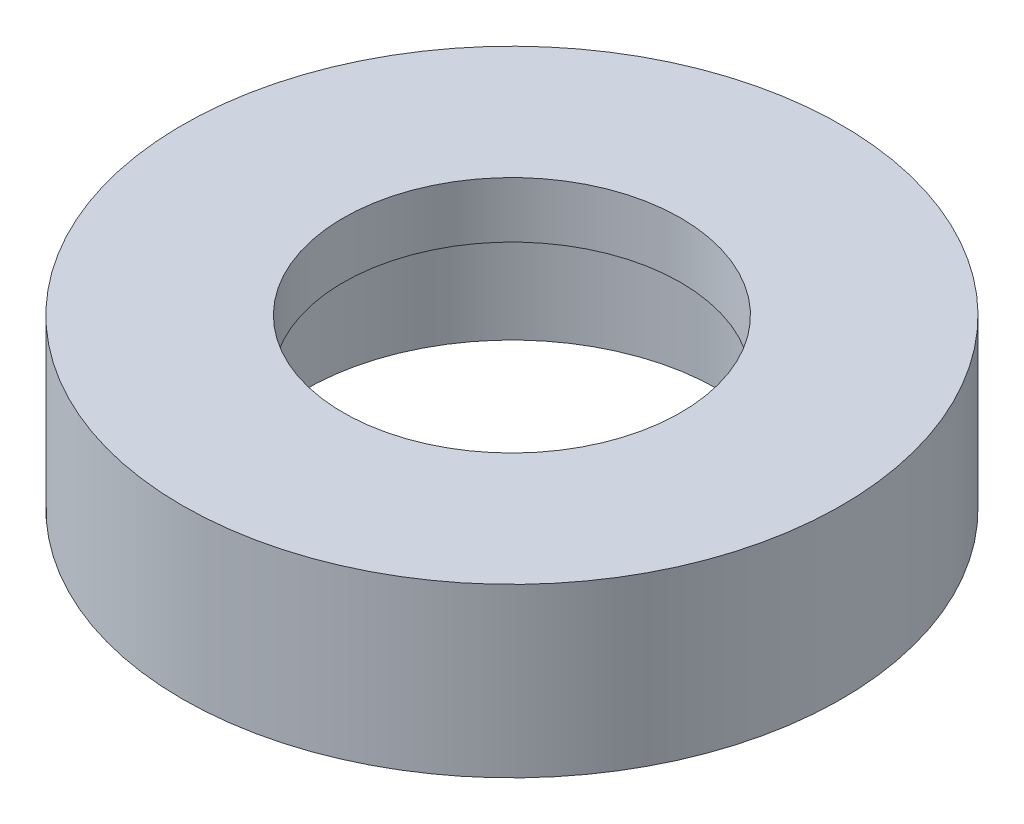
from build123d import *

# Parameters (mm, degrees)
SKETCH1_R           = 29.5
BOSS_EXTRUDE1_DEPTH = 15
SKETCH2_R           = 15.1
CUT_EXTRUDE1_DEPTH  = 45.333959895
SKETCH3_R           = 18.5
CUT_EXTRUDE2_DEPTH  = 10
SKETCH4_R           = 6
CUT_EXTRUDE3_DEPTH  = 10.5


with BuildPart() as part:
    # Sketch1 → Boss-Extrude1 (new body)
    with BuildSketch(Plane(origin=(0, 0, 0), x_dir=(1, 0, 0), z_dir=(0, 1, 0))):
        with Locations(Location((0, 0, 0), (0, 0, 270))):
            Circle(SKETCH1_R)
    extrude(amount=BOSS_EXTRUDE1_DEPTH)

    # Sketch2 → Cut-Extrude1 (cut, through all)
    with BuildSketch(Plane.XZ):
        with Locations(Location((0, 0, 0), (0, 0, 270))):
            Circle(SKETCH2_R)
    extrude(amount=-CUT_EXTRUDE1_DEPTH, mode=Mode.SUBTRACT)

    # Sketch3 → Cut-Extrude2 (cut)
    with BuildSketch(Plane.XZ):
        with Locations(Location((0, 0, 0), (0, 0, 270))):
            Circle(SKETCH3_R)
    extrude(amount=-CUT_EXTRUDE2_DEPTH, mode=Mode.SUBTRACT)

    # Sketch4 → Cut-Extrude3 (cut)
    with BuildSketch(Plane.XZ):
        with Locations(Location((21.406403657, 8.819380288, 0), (0, 0, 270))):
            Circle(SKETCH4_R)
    extrude(amount=-CUT_EXTRUDE3_DEPTH, mode=Mode.SUBTRACT)


solid = part.part
